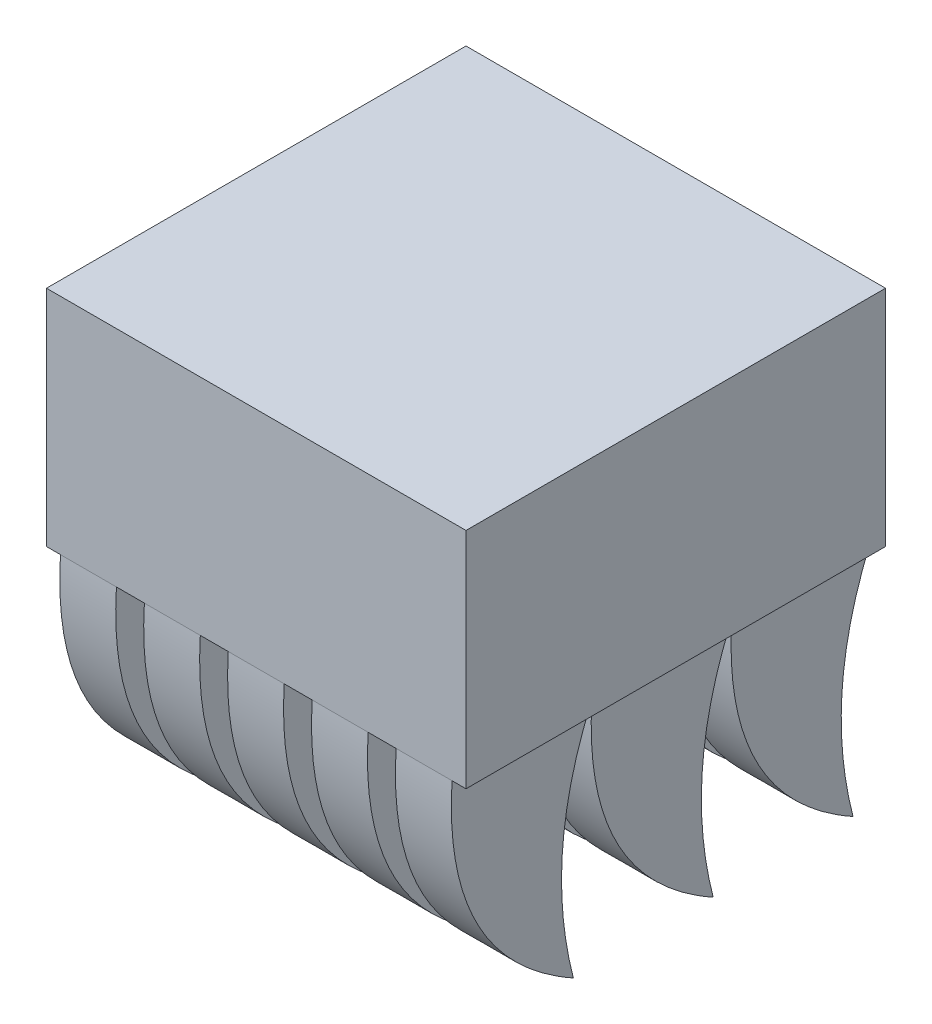
from build123d import *

# Parameters (mm, degrees)
SKETCH_1_W                  = 15
SKETCH_1_H                  = 15
EXTRUDE_1_DEPTH             = 4
EXTRUDE_2_DEPTH             = 1
PATTERN_LINEAR_1_COUNT      = 3
PATTERN_LINEAR_1_PITCH      = 3
PATTERN_LINEAR_1_COUNT_DIR2 = 3
PATTERN_LINEAR_1_PITCH_DIR2 = 5
PATTERN_LINEAR_2_COUNT      = 3
PATTERN_LINEAR_2_PITCH      = 3
PATTERN_LINEAR_2_COUNT_DIR2 = 3
PATTERN_LINEAR_2_PITCH_DIR2 = 5


with BuildPart() as part:
    # 스케치1 → 보스-돌출1 (new, symmetric)
    with BuildSketch(Plane(origin=(0, 0, 0), x_dir=(1, 0, 0), z_dir=(0, 1, 0))):
        Rectangle(SKETCH_1_W, SKETCH_1_H)
    extrude(amount=EXTRUDE_1_DEPTH, both=True)

    # 스케치3 → 보스-돌출2 (add, symmetric)
    with BuildSketch(Plane(origin=(0, 0, 0), x_dir=(0, 0, -1), z_dir=(1, 0, 0))):
        with BuildLine():
            Line((2.5, -4), (7.5, -4))
            add(Edge.make_bspline(
                [(6.837946582, -12.278081575), (5.73941202, -8.009656666), (7.5, -4)],
                knots=[0, 0, 0, 1, 1, 1], degree=2))
            add(Edge.make_bspline(
                [(2.5, -4), (2.152812134, -9.664313578), (6.837946582, -12.278081575)],
                knots=[0, 0, 0, 1, 1, 1], degree=2))
        make_face()
    extrude_2 = extrude(amount=EXTRUDE_2_DEPTH, both=True)

    # 선형 패턴1: Extrude 2 3 × 3
    with Locations(*[(-i * PATTERN_LINEAR_1_PITCH, 0, j * PATTERN_LINEAR_1_PITCH_DIR2) for i in range(PATTERN_LINEAR_1_COUNT) for j in range(PATTERN_LINEAR_1_COUNT_DIR2) if (i, j) != (0, 0)]):
        add(extrude_2)

    # 선형 패턴2: Extrude 2 3 × 3
    with Locations(*[(i * PATTERN_LINEAR_2_PITCH, 0, j * PATTERN_LINEAR_2_PITCH_DIR2) for i in range(PATTERN_LINEAR_2_COUNT) for j in range(PATTERN_LINEAR_2_COUNT_DIR2) if (i, j) != (0, 0)]):
        add(extrude_2)


solid = part.part
